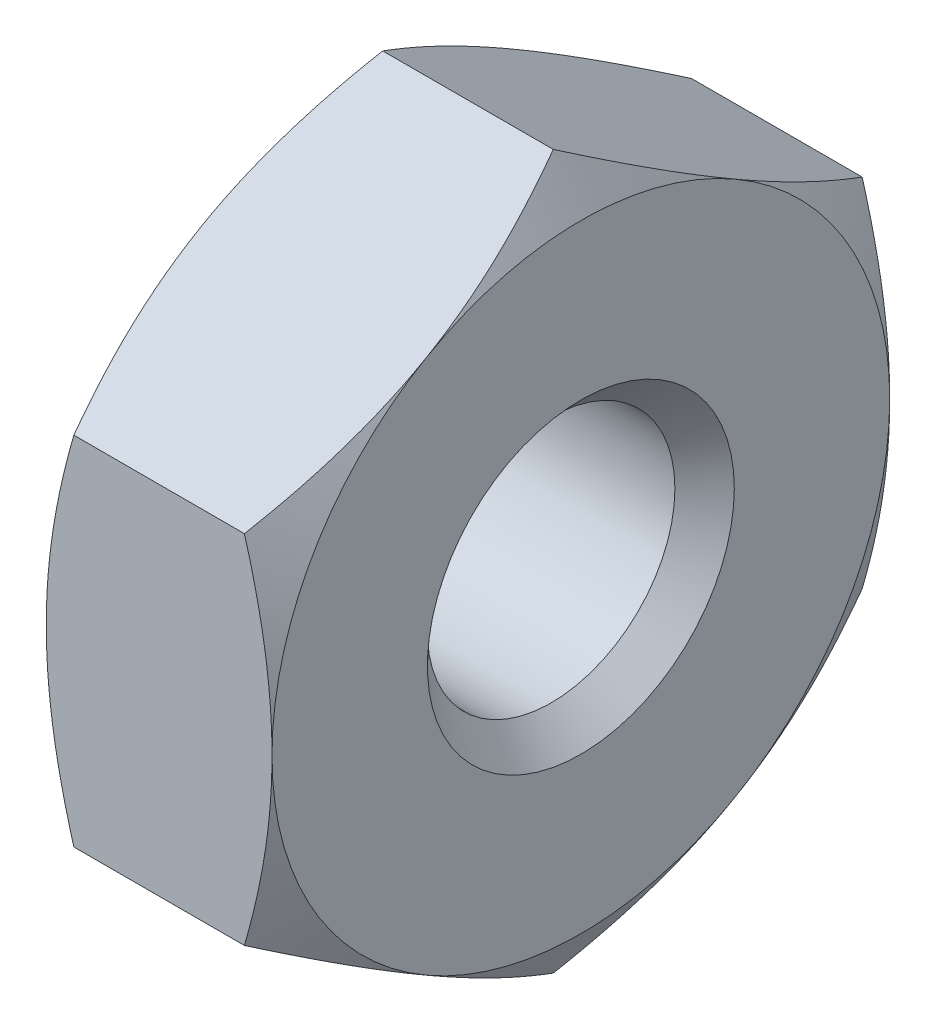
from build123d import *

# Parameters (mm, degrees)
SKETCH1_R               = 1.5875
BOSS_EXTRUDE2_DEPTH     = 2.8956
SKETCH2_OUTSIDE_W       = 39.12
SKETCH2_OUTSIDE_H       = 40.346
SKETCH2_OUTSIDE_R       = 3.9624
CUT_EXTRUDE7_DEPTH      = 7.709639692
CUT_EXTRUDE7_DRAFT      = -60
MIRROR1_COPY_1_SKETCH_W = 39.12
MIRROR1_COPY_1_SKETCH_H = 40.346
MIRROR1_COPY_1_SKETCH_R = 3.9624
MIRROR1_COPY_1_DEPTH    = 7.709639692
MIRROR1_COPY_1_DRAFT    = -60
CHAMFER1_SIZE           = 0.381


with BuildPart() as part:
    # Sketch1 → Boss-Extrude2 (new body)
    with BuildSketch(Plane(origin=(0, 0, 0), x_dir=(0, 0, -1), z_dir=(1, 0, 0))):
        Polygon((0, -4.575385413), (3.9624, -2.287692707), (3.9624, 2.287692707), (0, 4.575385413), (-3.9624, 2.287692707), (-3.9624, -2.287692707), align=None)
        Circle(SKETCH1_R, mode=Mode.SUBTRACT)
    extrude(amount=BOSS_EXTRUDE2_DEPTH)


with BuildPart() as cut_extrude7_tool:
    # Sketch2 outside → Cut-Extrude7 (with draft: the straight prism first)
    with BuildSketch(Plane.ZY):
        Rectangle(SKETCH2_OUTSIDE_W, SKETCH2_OUTSIDE_H)
        Circle(SKETCH2_OUTSIDE_R, mode=Mode.SUBTRACT)
    extrude(amount=-CUT_EXTRUDE7_DEPTH)
    # Cut-Extrude7: the draft: its side faces are tilted about the plane it starts from
    cut_extrude7_sides = [cut_extrude7_tool.faces().sort_by_distance(p)[0] for p in [
        (3.854819846, -20.173, 0),
        (3.854819846, 0, 19.56),
        (3.854819846, 20.173, 0),
        (3.854819846, 0, -19.56),
        (3.854819846, 0, -3.9624),
    ]]
    draft(cut_extrude7_sides, Plane.ZY, CUT_EXTRUDE7_DRAFT)


with BuildPart() as part_1:
    add(part.part)

    # Cut-Extrude7: cut by cut_extrude7_tool
    add(cut_extrude7_tool.part, mode=Mode.SUBTRACT)


with BuildPart() as mirror1_copy_1_tool:
    # Mirror1 copy 1 sketch → Mirror1 copy 1 (with draft: the straight prism first)
    with BuildSketch(Plane(origin=(2.8956, 0, 0), x_dir=(0, 0, 1), z_dir=(1, 0, 0))):
        Rectangle(MIRROR1_COPY_1_SKETCH_W, MIRROR1_COPY_1_SKETCH_H)
        Circle(MIRROR1_COPY_1_SKETCH_R, mode=Mode.SUBTRACT)
    extrude(amount=-MIRROR1_COPY_1_DEPTH)
    # Mirror1 copy 1: the draft: its side faces are tilted about the plane it starts from
    mirror1_copy_1_sides = [mirror1_copy_1_tool.faces().sort_by_distance(p)[0] for p in [
        (-0.959219846, -20.173, 0),
        (-0.959219846, 0, 19.56),
        (-0.959219846, 20.173, 0),
        (-0.959219846, 0, -19.56),
        (-0.959219846, 0, -3.9624),
    ]]
    draft(mirror1_copy_1_sides, Plane(origin=(2.8956, 0, 0), x_dir=(0, 0, 1), z_dir=(1, 0, 0)), MIRROR1_COPY_1_DRAFT)


with BuildPart() as part_2:
    add(part_1.part)

    # Mirror1 copy 1: cut by mirror1_copy_1_tool
    add(mirror1_copy_1_tool.part, mode=Mode.SUBTRACT)

    # Chamfer1
    chamfer1_edges = [part_2.edges().sort_by_distance(p)[0] for p in [
        (0, 0, 1.5875),
        (2.8956, 0, 1.5875),
    ]]
    chamfer(chamfer1_edges, length=CHAMFER1_SIZE)


solid = part_2.part
